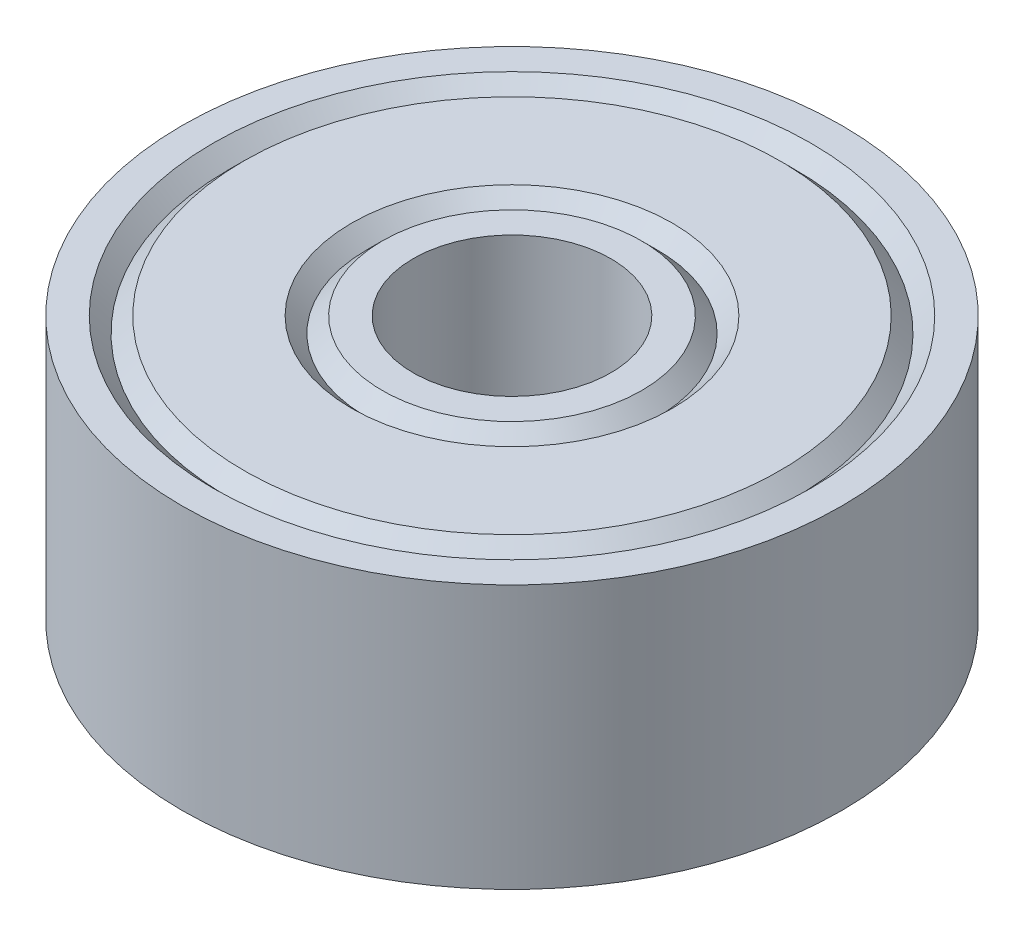
from build123d import *


with BuildPart() as part:
    # Sketch1 → Revolve1 (revolve)
    with BuildSketch(Plane.XY):
        Polygon((-1.5, 2), (-1.966666667, 2), (-2.2, 1.766666667), (-2.433333333, 2), (-4.066666667, 2), (-4.3, 1.766666667), (-4.533333333, 2), (-5, 2), (-5, -2), (-4.533333333, -2), (-4.3, -1.766666667), (-4.066666667, -2), (-2.433333333, -2), (-2.2, -1.766666667), (-1.966666667, -2), (-1.5, -2), align=None)
    revolve(axis=Axis((0, 2, 0), (0, -1, 0)))


solid = part.part
